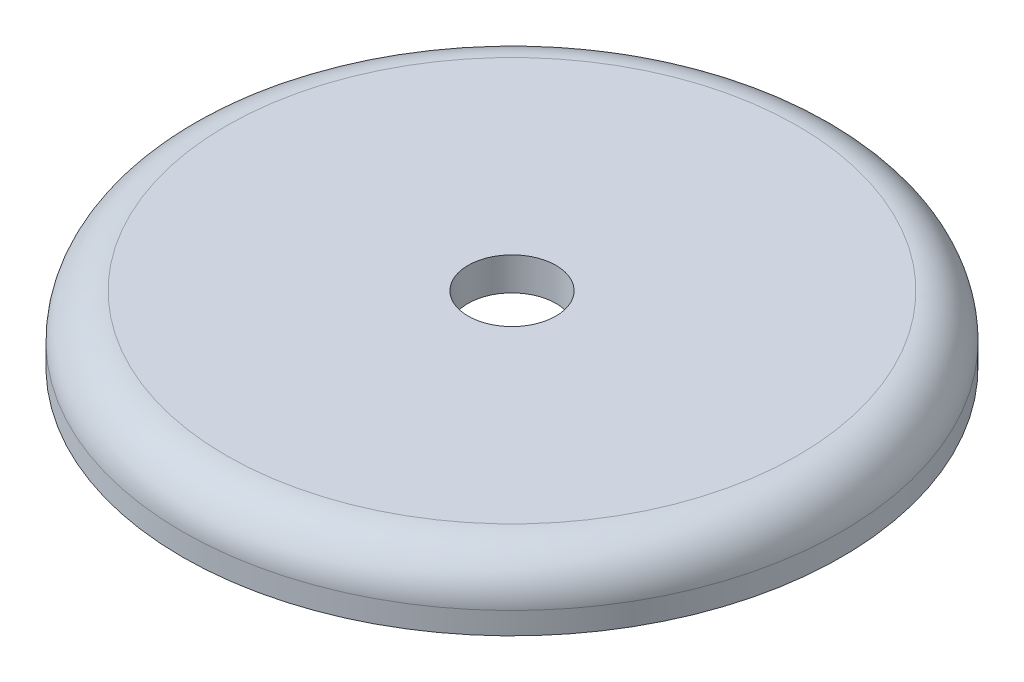
from build123d import *

# Parameters (mm, degrees)
SKETCH2_W          = 15
SKETCH2_H          = 3
SKETCH3_R          = 8
CUT_EXTRUDE1_DEPTH = 1.5
CUT_EXTRUDE2_DEPTH = 1.5
SKETCH5_R          = 2.6
CUT_EXTRUDE3_DEPTH = 1.8
FILLET1_R          = 2


with BuildPart() as part:
    # Sketch2 → Revolve1 (revolve)
    with BuildSketch(Plane.XY, mode=Mode.PRIVATE) as revolve1_sk:
        with Locations((7.5, 1.5)):
            Rectangle(SKETCH2_W, SKETCH2_H)
    revolve(revolve1_sk.sketch.rotate(Axis((0, 0, 0), (0, 1, 0)), 90), axis=Axis((0, 0, 0), (0, 1, 0)))

    # Sketch3 → Cut-Extrude1 (cut)
    with BuildSketch(Plane.XZ):
        with Locations(Location((0, 0, 0), (0, 0, 270))):
            Circle(SKETCH3_R)
    extrude(amount=-CUT_EXTRUDE1_DEPTH, mode=Mode.SUBTRACT)

    # Sketch4 → Cut-Extrude2 (cut)
    with BuildSketch(Plane.XZ.offset(-1.5)):
        with BuildLine():
            ThreePointArc((0, -2), (2, 0), (0, 2))
            ThreePointArc((0, 2), (-2, 0), (0, -2))
        make_face()
    extrude(amount=-CUT_EXTRUDE2_DEPTH, mode=Mode.SUBTRACT)

    # Sketch5 → Cut-Extrude3 (cut)
    with BuildSketch(Plane.XZ):
        with Locations(Location((0.41, -10.964999997, 0), (0, 0, 270))):
            Circle(SKETCH5_R)
        with Locations(Location((0.82, 10.965000003, 0), (0, 0, 270))):
            Circle(SKETCH5_R)
    extrude(amount=-CUT_EXTRUDE3_DEPTH, mode=Mode.SUBTRACT)

    # Fillet1
    fillet1_edges = [part.edges().sort_by_distance(p)[0] for p in [
        (0, 3, 15),
    ]]
    fillet(fillet1_edges, radius=FILLET1_R)


solid = part.part
